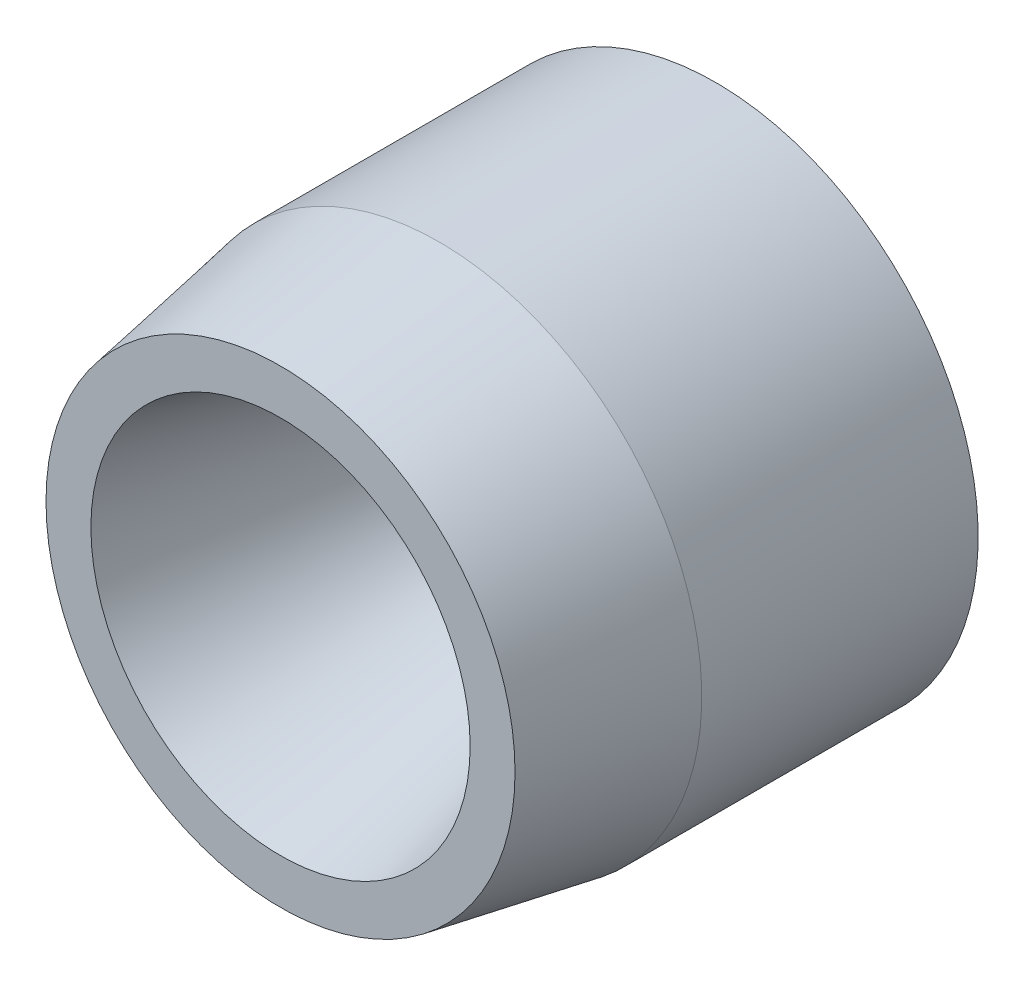
from build123d import *


with BuildPart() as part:
    # Sketch1 → Revolve1 (revolve)
    with BuildSketch(Plane(origin=(0, 0, 0), x_dir=(1, 0, 0), z_dir=(0, 1, 0)), mode=Mode.PRIVATE) as revolve1_sk:
        Polygon((18.415, 129.963013839), (18.415, 128.496544155), (44.3992, 143.49852902), (41.8592, 143.49852902), align=None)
        Polygon((44.3992, 96.750377662), (44.3992, 114.3), (44.3992, 143.49852902), (18.415, 128.496544155), (18.415, 120.876544155), (32.07390948, 69.9008), (39.664895038, 69.9008), (40.777169393, 76.208821327), align=None)
    revolve(revolve1_sk.sketch.rotate(Axis((0, 0, -147.178415471), (0, 0, 1)), 180), axis=Axis((0, 0, -147.178415471), (0, 0, 1)))


solid = part.part
